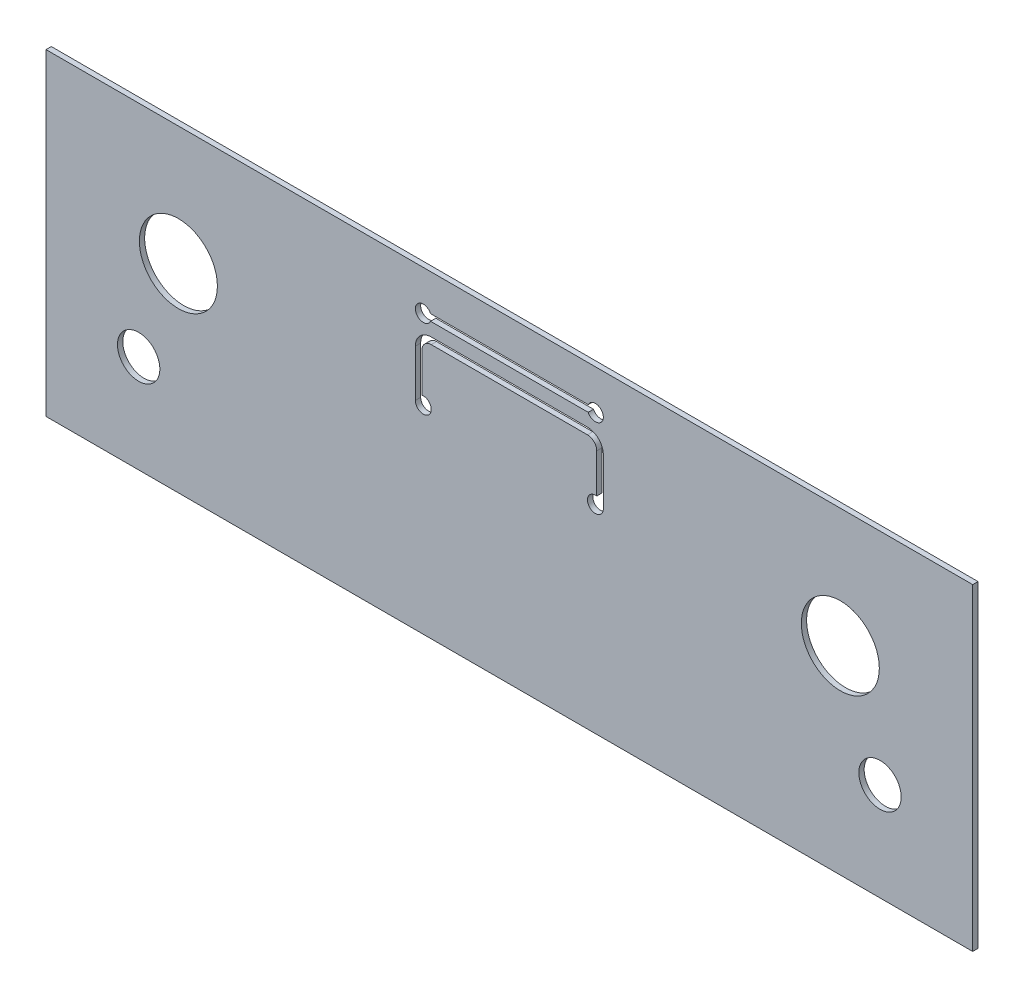
from build123d import *

# Parameters (mm, degrees)
SKETCH1_W           = 35
SKETCH1_H           = 12
SKETCH1_R           = 0.8001
SKETCH1_R_2         = 1.4732
BOSS_EXTRUDE1_DEPTH = 0.2


with BuildPart() as part:
    # Sketch1 → Boss-Extrude1 (new body)
    with BuildSketch(Plane.XY):
        with Locations((17.5, -6)):
            Rectangle(SKETCH1_W, SKETCH1_H)
        with Locations((3.5, -8.3)):
            Circle(SKETCH1_R, mode=Mode.SUBTRACT)
        with Locations((5, -4.5)):
            Circle(SKETCH1_R_2, mode=Mode.SUBTRACT)
        with Locations((30, -4.5)):
            Circle(SKETCH1_R_2, mode=Mode.SUBTRACT)
        with Locations((31.5, -8.3)):
            Circle(SKETCH1_R, mode=Mode.SUBTRACT)
        with BuildLine():
            Line((14.522717803, -1.375), (20.477282197, -1.375))
            ThreePointArc((20.477282197, -1.375), (21.05, -1.5), (20.477282197, -1.625))
            Line((20.477282197, -1.625), (14.522717803, -1.625))
            ThreePointArc((14.522717803, -1.625), (13.95, -1.5), (14.522717803, -1.375))
        make_face(mode=Mode.SUBTRACT)
        with BuildLine():
            Line((13.95, -4.5), (13.95, -2.725))
            ThreePointArc((13.95, -2.725), (14.125735931, -2.300735931), (14.55, -2.125))
            Line((14.55, -2.125), (20.45, -2.125))
            ThreePointArc((20.45, -2.125), (20.874264069, -2.300735931), (21.05, -2.725))
            Line((21.05, -2.725), (21.05, -4.5))
            ThreePointArc((21.05, -4.5), (20.520871215, -4.693649167), (20.8, -4.204196011))
            Line((20.8, -4.204196011), (20.8, -2.725))
            ThreePointArc((20.8, -2.725), (20.697487373, -2.477512627), (20.45, -2.375))
            Line((20.45, -2.375), (14.55, -2.375))
            ThreePointArc((14.55, -2.375), (14.302512627, -2.477512627), (14.2, -2.725))
            Line((14.2, -2.725), (14.2, -4.204196011))
            ThreePointArc((14.2, -4.204196011), (14.479128785, -4.693649167), (13.95, -4.5))
        make_face(mode=Mode.SUBTRACT)
    extrude(amount=BOSS_EXTRUDE1_DEPTH)


solid = part.part
